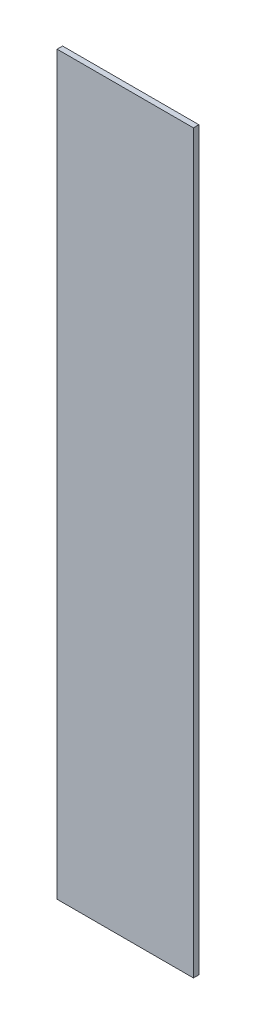
from build123d import *

# Parameters (mm, degrees)
SKETCH_1_W      = 250
SKETCH_1_H      = 1350
EXTRUDE_1_DEPTH = 10


with BuildPart() as part:
    # Эскиз1 → Бобышка-Вытянуть1 (new body)
    with BuildSketch(Plane.XY):
        with Locations((125, 675)):
            Rectangle(SKETCH_1_W, SKETCH_1_H)
    extrude(amount=EXTRUDE_1_DEPTH)


solid = part.part
